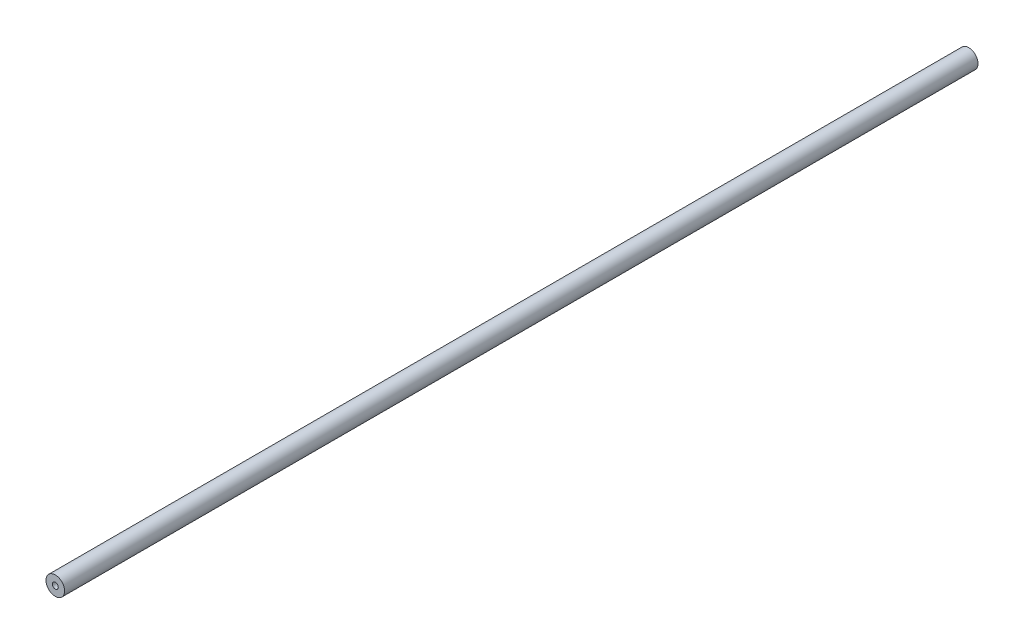
from build123d import *

# Parameters (mm, degrees)
SKETCH1_R                  = 6.35
BOSS_EXTRUDE1_DEPTH        = 622.808
F_10_32_TAPPED_HOLE1_D     = 4.0386
F_10_32_TAPPED_HOLE1_DEPTH = 13.716
F_10_32_TAPPED_HOLE1_TIP   = 1.213317848
F_10_32_TAPPED_HOLE2_D     = 4.0386
F_10_32_TAPPED_HOLE2_DEPTH = 13.716
F_10_32_TAPPED_HOLE2_TIP   = 1.213317848


with BuildPart() as part:
    # Sketch1 → Boss-Extrude1 (new body)
    with BuildSketch(Plane.XY):
        Circle(SKETCH1_R)
    extrude(amount=BOSS_EXTRUDE1_DEPTH)

    # #10-32 Tapped Hole1
    with Locations(Plane.XY.offset(622.808)):
        with Locations((0, 0)):
            Hole(F_10_32_TAPPED_HOLE1_D / 2, depth=F_10_32_TAPPED_HOLE1_DEPTH)
            with Locations((0, 0, -(F_10_32_TAPPED_HOLE1_DEPTH + F_10_32_TAPPED_HOLE1_TIP / 2))):  # 118° drill point
                Cone(0, F_10_32_TAPPED_HOLE1_D / 2, F_10_32_TAPPED_HOLE1_TIP, mode=Mode.SUBTRACT)

    # #10-32 Tapped Hole2
    with Locations(Plane(origin=(0, 0, 0), x_dir=(-1, 0, 0), z_dir=(0, 0, -1))):
        with Locations((0, 0)):
            Hole(F_10_32_TAPPED_HOLE2_D / 2, depth=F_10_32_TAPPED_HOLE2_DEPTH)
            with Locations((0, 0, -(F_10_32_TAPPED_HOLE2_DEPTH + F_10_32_TAPPED_HOLE2_TIP / 2))):  # 118° drill point
                Cone(0, F_10_32_TAPPED_HOLE2_D / 2, F_10_32_TAPPED_HOLE2_TIP, mode=Mode.SUBTRACT)


solid = part.part
